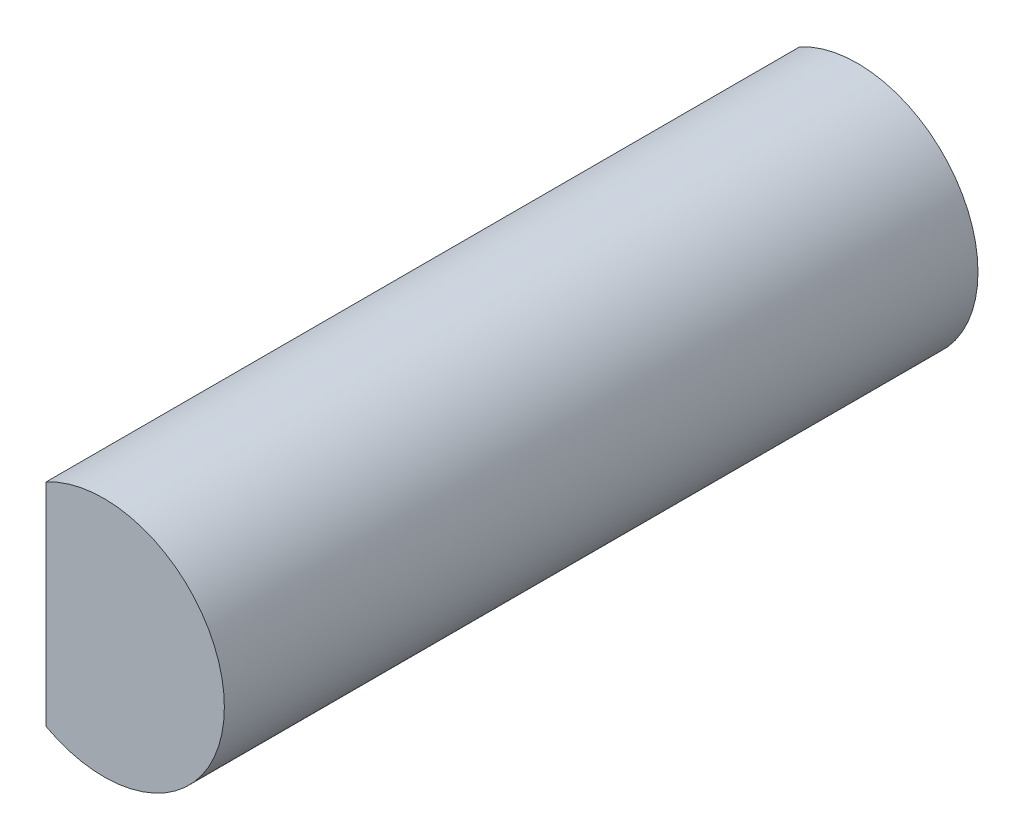
from build123d import *

# Parameters (mm, degrees)
BOSS_EXTRUDE1_DEPTH = 30


with BuildPart() as part:
    # Sketch1 → Boss-Extrude1 (new body)
    with BuildSketch(Plane.XY):
        with BuildLine():
            Line((-2.3, 4.213074887), (-2.3, -4.213074887))
            ThreePointArc((-2.3, -4.213074887), (4.8, 0), (-2.3, 4.213074887))
        make_face()
    extrude(amount=BOSS_EXTRUDE1_DEPTH)


solid = part.part
